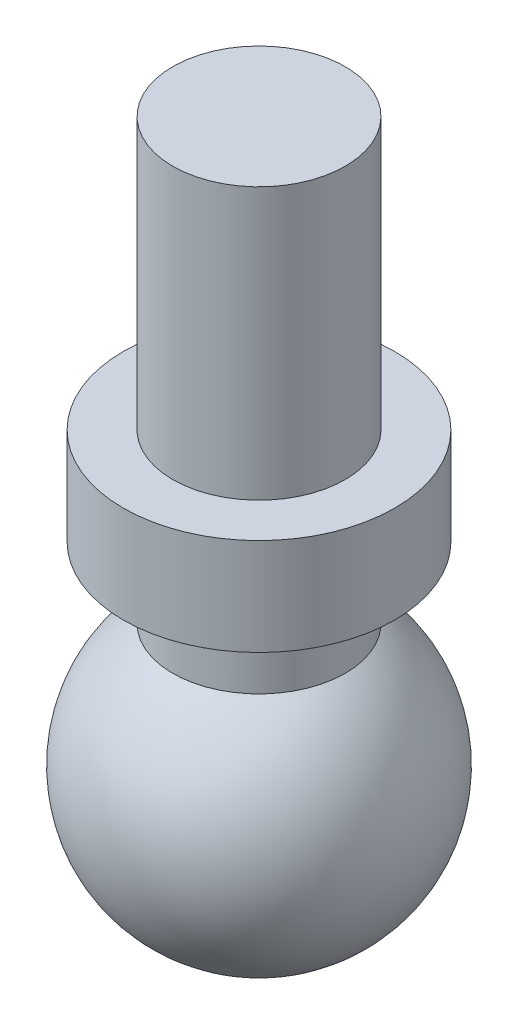
from build123d import *

# Parameters (mm, degrees)
SKETCH4_R      = 1.1303
EXTRUDE1_DEPTH = 7.366
SKETCH5_R      = 1.778
EXTRUDE2_DEPTH = 1.27


with BuildPart() as part:
    # Sketch3 → Revolve1 (revolve)
    with BuildSketch(Plane.XY):
        with BuildLine():
            Line((0, 1.9685), (0, -1.9685))
            ThreePointArc((0, -1.9685), (1.9685, 0), (0, 1.9685))
        make_face()
    revolve(axis=Axis((0, 1.9685, 0), (0, -1, 0)))

    # Sketch4 → Extrude1 (add)
    with BuildSketch(Plane(origin=(0, 0, 0), x_dir=(-1, 0, 0), z_dir=(0, 1, 0))):
        with Locations(Location((0, 0, 0), (0, 0, 270))):
            Circle(SKETCH4_R)
    extrude(amount=EXTRUDE1_DEPTH)

    # Sketch5 → Extrude2 (add)
    with BuildSketch(Plane(origin=(0, 2.54, 0), x_dir=(-1, 0, 0), z_dir=(0, 1, 0))):
        with Locations(Location((0, 0, 0), (0, 0, 90))):
            Circle(SKETCH5_R)
    extrude(amount=EXTRUDE2_DEPTH)


solid = part.part
